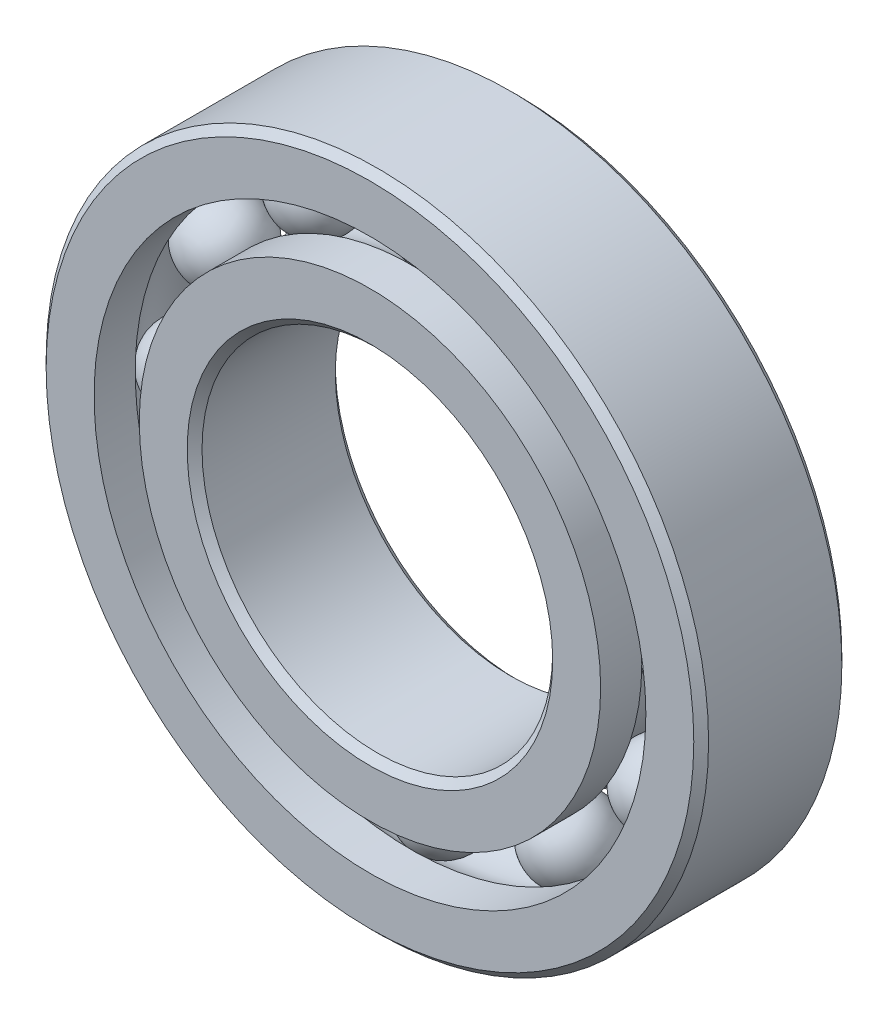
from build123d import *

# Parameters (mm, degrees)
CIRPATTERN1_COUNT = 12


with BuildPart() as part:
    # Sketch1 → Revolve1 (revolve)
    with BuildSketch(Plane(origin=(0, 0, 0), x_dir=(0, 0, -1), z_dir=(1, 0, 0))):
        with BuildLine():
            Line((8.55, 42.5), (-8.55, 42.5))
            Line((-8.55, 42.5), (-9.5, 41.55))
            Line((-9.5, 41.55), (-9.5, 35.400848901))
            Line((-9.5, 35.400848901), (-4.222222222, 35.400848901))
            ThreePointArc((-4.222222222, 35.400848901), (0, 37.622594457), (4.222222222, 35.400848901))
            Line((4.222222222, 35.400848901), (9.5, 35.400848901))
            Line((9.5, 35.400848901), (9.5, 41.55))
            Line((9.5, 41.55), (8.55, 42.5))
        make_face()
    revolve(axis=Axis((0, 0, 9.5), (0, 0, -1)))


with BuildPart() as body_2:
    # Sketch3 → Revolve3 (revolve)
    with BuildSketch(Plane(origin=(0, 0, 0), x_dir=(0, 0, -1), z_dir=(1, 0, 0))):
        with BuildLine():
            Line((-9.5, 29.598651099), (-4.222222222, 29.598651099))
            ThreePointArc((-4.222222222, 29.598651099), (0, 27.376905543), (4.222222222, 29.598651099))
            Line((4.222222222, 29.598651099), (9.5, 29.598651099))
            Line((9.5, 29.598651099), (9.5, 23.4495))
            Line((9.5, 23.4495), (8.55, 22.4995))
            Line((8.55, 22.4995), (-8.55, 22.4995))
            Line((-8.55, 22.4995), (-9.5, 23.4495))
            Line((-9.5, 23.4495), (-9.5, 29.598651099))
        make_face()
    revolve(axis=Axis((0, 0, 9.5), (0, 0, -1)))


with BuildPart() as body_3:
    # Sketch4 → Revolve4 (revolve)
    with BuildSketch(Plane(origin=(0, 0, 0), x_dir=(0, 0, -1), z_dir=(1, 0, 0))):
        with BuildLine():
            Line((-5.122844457, 32.49975), (5.122844457, 32.49975))
            ThreePointArc((5.122844457, 32.49975), (0, 37.622594457), (-5.122844457, 32.49975))
        make_face()
    revolve(axis=Axis((0, 32.49975, 5.122844457), (0, 0, -1)))


with BuildPart() as cirpattern1_1:
    # CirPattern1: pattern copy
    add(body_3.part.rotate(Axis((0, 0, -9.5), (0, 0, 1)), 1 * 360 / CIRPATTERN1_COUNT))


with BuildPart() as cirpattern1_2:
    # CirPattern1: pattern copy
    add(body_3.part.rotate(Axis((0, 0, -9.5), (0, 0, 1)), 2 * 360 / CIRPATTERN1_COUNT))


with BuildPart() as cirpattern1_3:
    # CirPattern1: pattern copy
    add(body_3.part.rotate(Axis((0, 0, -9.5), (0, 0, 1)), 3 * 360 / CIRPATTERN1_COUNT))


with BuildPart() as cirpattern1_4:
    # CirPattern1: pattern copy
    add(body_3.part.rotate(Axis((0, 0, -9.5), (0, 0, 1)), 4 * 360 / CIRPATTERN1_COUNT))


with BuildPart() as cirpattern1_5:
    # CirPattern1: pattern copy
    add(body_3.part.rotate(Axis((0, 0, -9.5), (0, 0, 1)), 5 * 360 / CIRPATTERN1_COUNT))


with BuildPart() as cirpattern1_6:
    # CirPattern1: pattern copy
    add(body_3.part.rotate(Axis((0, 0, -9.5), (0, 0, 1)), 6 * 360 / CIRPATTERN1_COUNT))


with BuildPart() as cirpattern1_7:
    # CirPattern1: pattern copy
    add(body_3.part.rotate(Axis((0, 0, -9.5), (0, 0, 1)), 7 * 360 / CIRPATTERN1_COUNT))


with BuildPart() as cirpattern1_8:
    # CirPattern1: pattern copy
    add(body_3.part.rotate(Axis((0, 0, -9.5), (0, 0, 1)), 8 * 360 / CIRPATTERN1_COUNT))


with BuildPart() as cirpattern1_9:
    # CirPattern1: pattern copy
    add(body_3.part.rotate(Axis((0, 0, -9.5), (0, 0, 1)), 9 * 360 / CIRPATTERN1_COUNT))


with BuildPart() as cirpattern1_10:
    # CirPattern1: pattern copy
    add(body_3.part.rotate(Axis((0, 0, -9.5), (0, 0, 1)), 10 * 360 / CIRPATTERN1_COUNT))


with BuildPart() as cirpattern1_11:
    # CirPattern1: pattern copy
    add(body_3.part.rotate(Axis((0, 0, -9.5), (0, 0, 1)), 11 * 360 / CIRPATTERN1_COUNT))


solid = Compound([part.part, body_2.part, body_3.part, cirpattern1_1.part, cirpattern1_2.part, cirpattern1_3.part, cirpattern1_4.part, cirpattern1_5.part, cirpattern1_6.part, cirpattern1_7.part, cirpattern1_8.part, cirpattern1_9.part, cirpattern1_10.part, cirpattern1_11.part])
